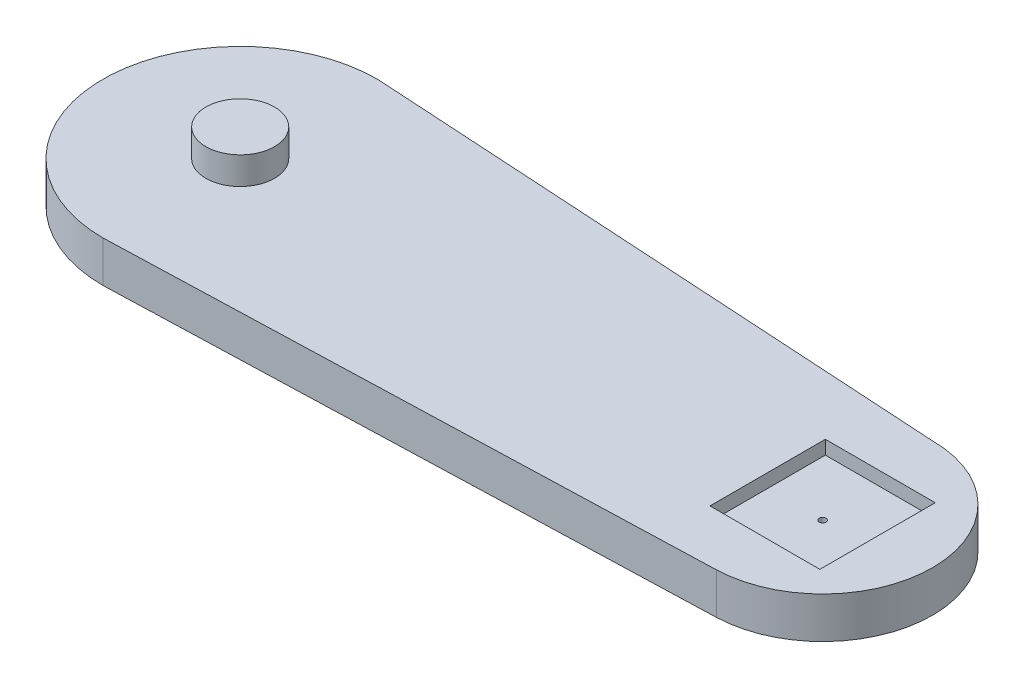
from build123d import *

# Parameters (mm, degrees)
CROQUIS1_R              = 1.25
SALIENTE_EXTRUIR1_DEPTH = 15
CROQUIS2_R              = 12.5
SALIENTE_EXTRUIR2_DEPTH = 10
CROQUIS3_R              = 11
CORTAR_EXTRUIR1_DEPTH   = 5
CROQUIS4_W              = 40
CROQUIS4_H              = 42
CORTAR_EXTRUIR2_DEPTH   = 5


with BuildPart() as part:
    # Croquis1 → Saliente-Extruir1 (new body)
    with BuildSketch(Plane(origin=(0, 0, 0), x_dir=(1, 0, 0), z_dir=(0, 1, 0))):
        with BuildLine():
            Line((0, 50), (215, 37.002241847))
            ThreePointArc((215, 37.002241847), (254.994732146, -2.34860444), (216.298136444, -42.976688126))
            Line((216.298136444, -42.976688126), (0, -50))
            ThreePointArc((0, -50), (-50, 0), (0, 50))
        make_face()
        with Locations(Location((0, 0, 0), (0, 0, 270))):
            Circle(CROQUIS1_R, mode=Mode.SUBTRACT)
        with Locations(Location((215, -2.997758153, 0), (0, 0, 270))):
            Circle(CROQUIS1_R, mode=Mode.SUBTRACT)
    extrude(amount=SALIENTE_EXTRUIR1_DEPTH)

    # Croquis2 → Saliente-Extruir2 (add)
    with BuildSketch(Plane(origin=(0, 15, 0), x_dir=(1, 0, 0), z_dir=(0, 1, 0))):
        with Locations(Location((0, 0, 0), (0, 0, 270))):
            Circle(CROQUIS2_R)
    extrude(amount=SALIENTE_EXTRUIR2_DEPTH)

    # Croquis3 → Cortar-Extruir1 (cut)
    with BuildSketch(Plane(origin=(0, 0, 0), x_dir=(-1, 0, 0), z_dir=(0, -1, 0))):
        with Locations(Location((0, 0, 0), (0, 0, 90))):
            Circle(CROQUIS3_R)
    extrude(amount=-CORTAR_EXTRUIR1_DEPTH, mode=Mode.SUBTRACT)

    # Croquis4 → Cortar-Extruir2 (cut)
    with BuildSketch(Plane(origin=(0, 15, 0), x_dir=(1, 0, 0), z_dir=(0, 1, 0))):
        with Locations((215, -2.997758153)):
            Rectangle(CROQUIS4_W, CROQUIS4_H)
    extrude(amount=-CORTAR_EXTRUIR2_DEPTH, mode=Mode.SUBTRACT)


solid = part.part
